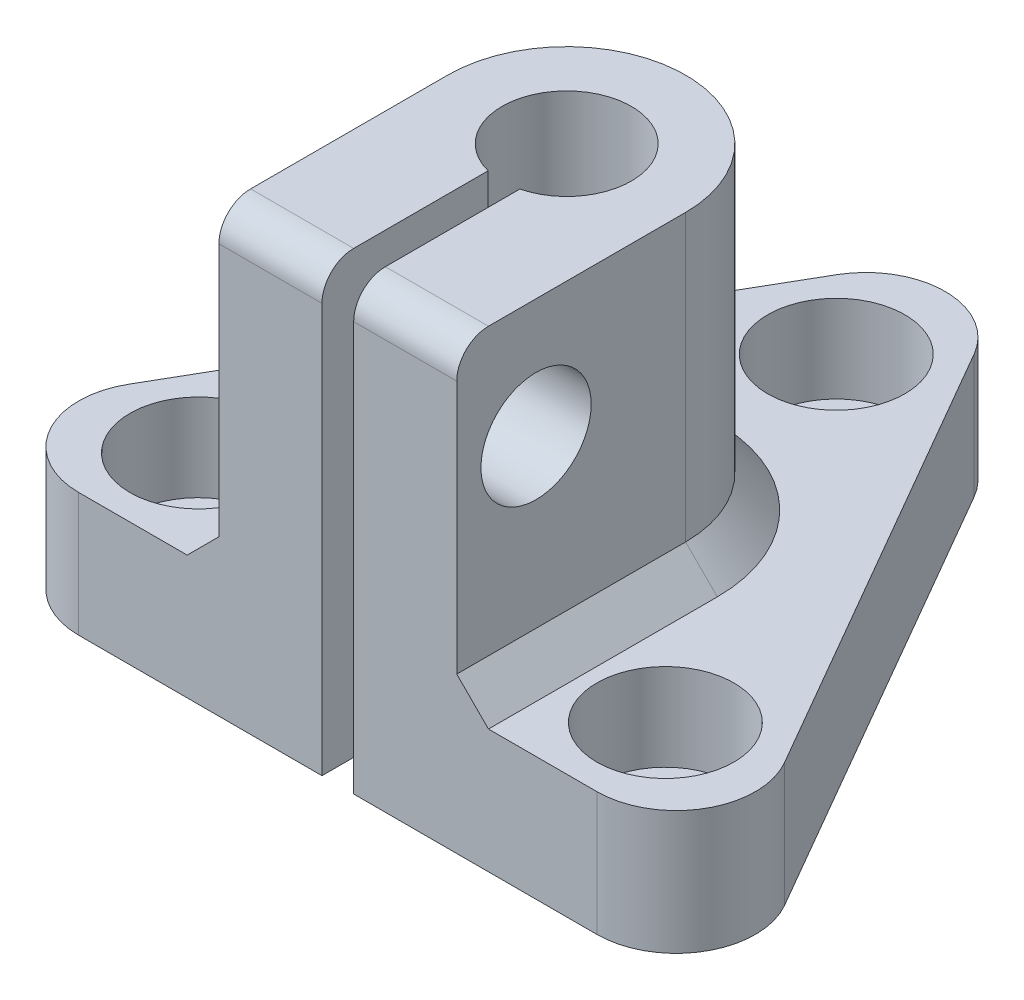
from build123d import *

# Parameters (mm, degrees)
ESQUISSE5_R             = 2.575
BOSS_EXTRU_2_DEPTH      = 7.8
ESQUISSE6_R             = 7.5
BOSS_EXTRU_3_DEPTH      = 20
BOSS_EXTRU_6_START      = -20
BOSS_EXTRU_6_DEPTH      = 20
ESQUISSE14_R            = 4.08
ENL_V_MAT_EXTRU_4_DEPTH = 48.235297536
ENL_V_MAT_EXTRU_5_DEPTH = 48.235297536
CONG_2_R                = 5
ESQUISSE17_R            = 2.05
ENL_V_MAT_EXTRU_6_DEPTH = 47.62863011
ENL_V_MAT_EXTRU_7_DEPTH = 3.25
ESQUISSE19_R            = 4.325
ENL_V_MAT_EXTRU_8_DEPTH = 5.5
ESQUISSE20_R            = 3.475
ENL_V_MAT_EXTRU_9_DEPTH = 4.97
CONG_3_R                = 2
CHANFREIN2_SIZE         = 2


with BuildPart() as part:
    # Esquisse5 → Boss.-Extru.2 (new body)
    with BuildSketch(Plane(origin=(0, 0, 0), x_dir=(1, 0, 0), z_dir=(0, 1, 0))):
        Polygon((-25, -14.43375673), (25, -14.43375673), (0, 28.867513459), align=None)
        with Locations(Location((0, 17, 0), (0, 0, 270))):
            Circle(ESQUISSE5_R, mode=Mode.SUBTRACT)
        with Locations(Location((-14.722431864, -8.5, 0), (0, 0, 270))):
            Circle(ESQUISSE5_R, mode=Mode.SUBTRACT)
        with Locations(Location((14.722431864, -8.5, 0), (0, 0, 270))):
            Circle(ESQUISSE5_R, mode=Mode.SUBTRACT)
    extrude(amount=BOSS_EXTRU_2_DEPTH)

    # Esquisse6 → Boss.-Extru.3 (add)
    with BuildSketch(Plane(origin=(0, 7.8, 0), x_dir=(1, 0, 0), z_dir=(0, 1, 0))):
        with Locations(Location((0, 0, 0), (0, 0, 270))):
            Circle(ESQUISSE6_R)
    extrude(amount=BOSS_EXTRU_3_DEPTH)

    # Esquisse13 → Boss.-Extru.6 (add)
    with BuildSketch(Plane(origin=(0, 27.8, 0), x_dir=(1, 0, 0), z_dir=(0, 1, 0)).offset(BOSS_EXTRU_6_START)):
        with BuildLine():
            Line((-7.5, 0), (-7.5, -14.43375673))
            Line((-7.5, -14.43375673), (7.5, -14.43375673))
            Line((7.5, -14.43375673), (7.5, 0))
            ThreePointArc((7.5, 0), (0, -7.5), (-7.5, 0))
        make_face()
    extrude(amount=BOSS_EXTRU_6_DEPTH)

    # Esquisse14 → Enlèv. mat.-Extru.4 (cut, through all)
    with BuildSketch(Plane(origin=(0, 27.8, 0), x_dir=(1, 0, 0), z_dir=(0, 1, 0))):
        with Locations(Location((0, 0, 0), (0, 0, 270))):
            Circle(ESQUISSE14_R)
    extrude(amount=-ENL_V_MAT_EXTRU_4_DEPTH, mode=Mode.SUBTRACT)

    # Esquisse15 → Enlèv. mat.-Extru.5 (cut, through all)
    with BuildSketch(Plane(origin=(0, 27.8, 0), x_dir=(1, 0, 0), z_dir=(0, 1, 0))):
        with BuildLine():
            Line((-1, -3.955553059), (-1, -14.43375673))
            Line((-1, -14.43375673), (1, -14.43375673))
            Line((1, -14.43375673), (1, -3.955553059))
            ThreePointArc((1, -3.955553059), (0, -4.08), (-1, -3.955553059))
        make_face()
    extrude(amount=-ENL_V_MAT_EXTRU_5_DEPTH, mode=Mode.SUBTRACT)

    # Congé2
    cong_2_edges = [part.edges().sort_by_distance(p)[0] for p in [
        (0, 3.9, -28.867513459),
        (25, 3.9, 14.43375673),
        (-25, 3.9, 14.43375673),
    ]]
    fillet(cong_2_edges, radius=CONG_2_R)

    # Esquisse17 → Enlèv. mat.-Extru.6 (cut, through all)
    with BuildSketch(Plane(origin=(7.5, 0, 0), x_dir=(0, 0, -1), z_dir=(1, 0, 0))):
        with Locations((-9.43375673, 20.3)):
            Circle(ESQUISSE17_R)
    extrude(amount=-ENL_V_MAT_EXTRU_6_DEPTH, mode=Mode.SUBTRACT)

    # Esquisse18 → Enlèv. mat.-Extru.7 (cut)
    with BuildSketch(Plane.ZY.offset(7.5)):
        Polygon((11.468916429, 23.825), (7.398597031, 23.825), (5.363437332, 20.3), (7.398597031, 16.775), (11.468916429, 16.775), (13.504076128, 20.3), align=None)
    extrude(amount=-ENL_V_MAT_EXTRU_7_DEPTH, mode=Mode.SUBTRACT)

    # Esquisse19 → Enlèv. mat.-Extru.8 (cut)
    with BuildSketch(Plane(origin=(0, 7.8, 0), x_dir=(1, 0, 0), z_dir=(0, 1, 0))):
        with Locations(Location((0, 17, 0), (0, 0, 270))):
            Circle(ESQUISSE19_R)
        with Locations(Location((14.722431864, -8.5, 0), (0, 0, 270))):
            Circle(ESQUISSE19_R)
        with Locations(Location((-14.722431864, -8.5, 0), (0, 0, 270))):
            Circle(ESQUISSE19_R)
    extrude(amount=-ENL_V_MAT_EXTRU_8_DEPTH, mode=Mode.SUBTRACT)

    # Esquisse20 → Enlèv. mat.-Extru.9 (cut)
    with BuildSketch(Plane(origin=(7.5, 0, 0), x_dir=(0, 0, -1), z_dir=(1, 0, 0))):
        with Locations((-9.43375673, 20.3)):
            Circle(ESQUISSE20_R)
    extrude(amount=-ENL_V_MAT_EXTRU_9_DEPTH, mode=Mode.SUBTRACT)

    # Congé3
    cong_3_edges = [part.edges().sort_by_distance(p)[0] for p in [
        (-4.25, 27.8, 14.43375673),
        (4.25, 27.8, 14.43375673),
    ]]
    fillet(cong_3_edges, radius=CONG_3_R)

    # Chanfrein2
    chanfrein2_edges = [part.edges().sort_by_distance(p)[0] for p in [
        (0, 7.8, -7.5),
        (7.5, 7.8, 7.216878365),
        (-7.5, 7.8, 7.216878365),
    ]]
    chamfer(chanfrein2_edges, length=CHANFREIN2_SIZE)


solid = part.part
